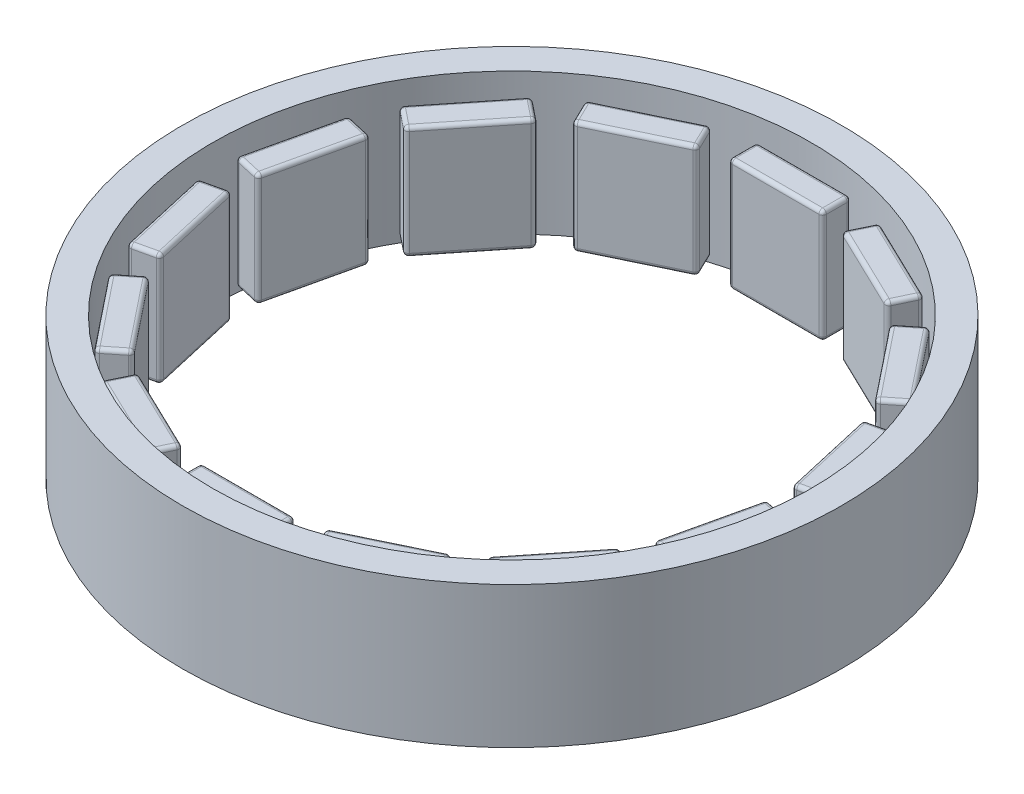
from build123d import *

# Parameters (mm, degrees)
SKETCH_1_R               = 17.5
SKETCH_1_R_2             = 15.9
EXTRUDE_1_DEPTH          = 7.5
EXTRUDE_START            = -1
EXTRUDE_2_DEPTH          = 6
FILLET_1_R               = 0.2
PATTERN_CIRCULAR_3_COUNT = 14


with BuildPart() as part:
    # Эскиз1 → Бобышка-Вытянуть1 (new body)
    with BuildSketch(Plane(origin=(0, 0, 0), x_dir=(1, 0, 0), z_dir=(0, 1, 0))):
        with Locations(Location((0, 0, 0), (0, 0, 270))):
            Circle(SKETCH_1_R)
        with Locations(Location((0, 0, 0), (0, 0, 270))):
            Circle(SKETCH_1_R_2, mode=Mode.SUBTRACT)
    extrude(amount=EXTRUDE_1_DEPTH)


with BuildPart() as body_2:
    # Эскиз2 → Бобышка-Вытянуть2 (new body)
    with BuildSketch(Plane(origin=(0, 7.5, 0), x_dir=(1, 0, 0), z_dir=(0, 1, 0)).offset(EXTRUDE_START)):
        with BuildLine():
            Line((-2.3, 14), (2.3, 14))
            ThreePointArc((2.3, 14), (2.441421356, 14.058578644), (2.5, 14.2))
            Line((2.5, 14.2), (2.5, 15.3))
            ThreePointArc((2.5, 15.3), (2.441421356, 15.441421356), (2.3, 15.5))
            Line((2.3, 15.5), (-2.3, 15.5))
            ThreePointArc((-2.3, 15.5), (-2.441421356, 15.441421356), (-2.5, 15.3))
            Line((-2.5, 15.3), (-2.5, 14.2))
            ThreePointArc((-2.5, 14.2), (-2.441421356, 14.058578644), (-2.3, 14))
        make_face()
    extrude(amount=-EXTRUDE_2_DEPTH)

    # Скругление1
    fillet_1_edges = [body_2.edges().sort_by_distance(p)[0] for p in [
        (-2.5, 6.5, -14.75),
        (-2.441421356, 6.5, -15.441421356),
        (0, 6.5, -15.5),
        (2.441421356, 6.5, -15.441421356),
        (-2.441421356, 0.5, -15.441421356),
        (-2.5, 0.5, -14.75),
        (-2.441421356, 0.5, -14.058578644),
        (0, 0.5, -14),
        (2.441421356, 0.5, -14.058578644),
        (2.5, 0.5, -14.75),
        (2.441421356, 0.5, -15.441421356),
        (2.5, 6.5, -14.75),
        (0, 0.5, -15.5),
        (2.441421356, 6.5, -14.058578644),
        (0, 6.5, -14),
        (-2.441421356, 6.5, -14.058578644),
    ]]
    fillet(fillet_1_edges, radius=FILLET_1_R)


with BuildPart() as pattern_circular_3_1:
    # Круговой массив3: pattern copy
    add(body_2.part.rotate(Axis((0, 0, 0), (0, 1, 0)), 1 * 360 / PATTERN_CIRCULAR_3_COUNT))


with BuildPart() as pattern_circular_3_2:
    # Круговой массив3: pattern copy
    add(body_2.part.rotate(Axis((0, 0, 0), (0, 1, 0)), 2 * 360 / PATTERN_CIRCULAR_3_COUNT))


with BuildPart() as pattern_circular_3_3:
    # Круговой массив3: pattern copy
    add(body_2.part.rotate(Axis((0, 0, 0), (0, 1, 0)), 3 * 360 / PATTERN_CIRCULAR_3_COUNT))


with BuildPart() as pattern_circular_3_4:
    # Круговой массив3: pattern copy
    add(body_2.part.rotate(Axis((0, 0, 0), (0, 1, 0)), 4 * 360 / PATTERN_CIRCULAR_3_COUNT))


with BuildPart() as pattern_circular_3_5:
    # Круговой массив3: pattern copy
    add(body_2.part.rotate(Axis((0, 0, 0), (0, 1, 0)), 5 * 360 / PATTERN_CIRCULAR_3_COUNT))


with BuildPart() as pattern_circular_3_6:
    # Круговой массив3: pattern copy
    add(body_2.part.rotate(Axis((0, 0, 0), (0, 1, 0)), 6 * 360 / PATTERN_CIRCULAR_3_COUNT))


with BuildPart() as pattern_circular_3_7:
    # Круговой массив3: pattern copy
    add(body_2.part.rotate(Axis((0, 0, 0), (0, 1, 0)), 7 * 360 / PATTERN_CIRCULAR_3_COUNT))


with BuildPart() as pattern_circular_3_8:
    # Круговой массив3: pattern copy
    add(body_2.part.rotate(Axis((0, 0, 0), (0, 1, 0)), 8 * 360 / PATTERN_CIRCULAR_3_COUNT))


with BuildPart() as pattern_circular_3_9:
    # Круговой массив3: pattern copy
    add(body_2.part.rotate(Axis((0, 0, 0), (0, 1, 0)), 9 * 360 / PATTERN_CIRCULAR_3_COUNT))


with BuildPart() as pattern_circular_3_10:
    # Круговой массив3: pattern copy
    add(body_2.part.rotate(Axis((0, 0, 0), (0, 1, 0)), 10 * 360 / PATTERN_CIRCULAR_3_COUNT))


with BuildPart() as pattern_circular_3_11:
    # Круговой массив3: pattern copy
    add(body_2.part.rotate(Axis((0, 0, 0), (0, 1, 0)), 11 * 360 / PATTERN_CIRCULAR_3_COUNT))


with BuildPart() as pattern_circular_3_12:
    # Круговой массив3: pattern copy
    add(body_2.part.rotate(Axis((0, 0, 0), (0, 1, 0)), 12 * 360 / PATTERN_CIRCULAR_3_COUNT))


with BuildPart() as pattern_circular_3_13:
    # Круговой массив3: pattern copy
    add(body_2.part.rotate(Axis((0, 0, 0), (0, 1, 0)), 13 * 360 / PATTERN_CIRCULAR_3_COUNT))


solid = Compound([part.part, body_2.part, pattern_circular_3_1.part, pattern_circular_3_2.part, pattern_circular_3_3.part, pattern_circular_3_4.part, pattern_circular_3_5.part, pattern_circular_3_6.part, pattern_circular_3_7.part, pattern_circular_3_8.part, pattern_circular_3_9.part, pattern_circular_3_10.part, pattern_circular_3_11.part, pattern_circular_3_12.part, pattern_circular_3_13.part])
